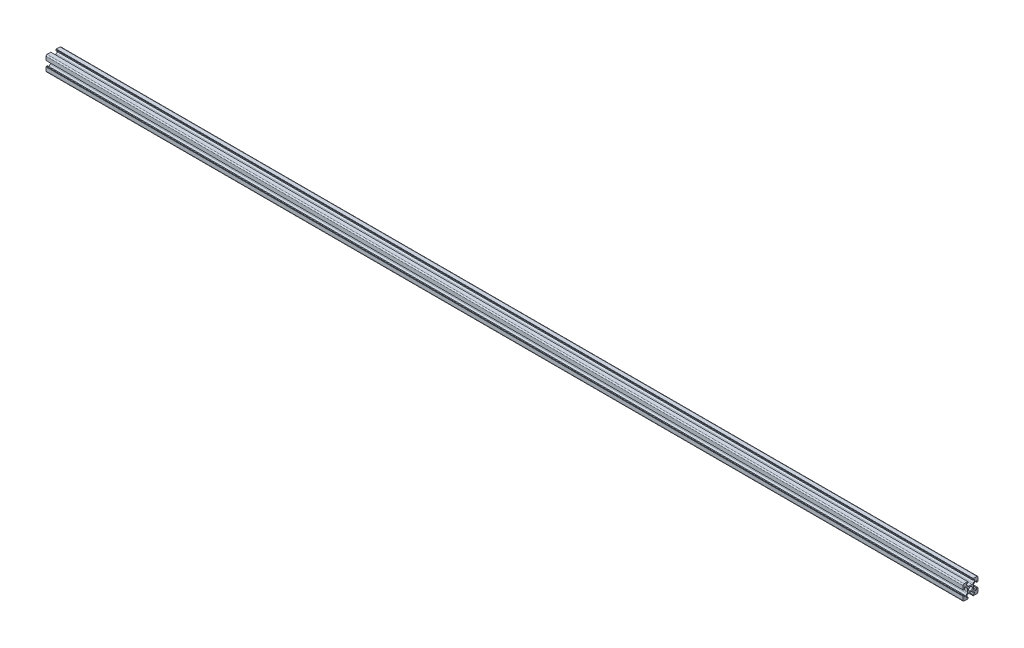
from build123d import *

# Parameters (mm, degrees)
SKETCH2_R           = 2.5
BOSS_EXTRUDE1_DEPTH = 1219.2


with BuildPart() as part:
    # Sketch2 → Boss-Extrude1 (new body)
    with BuildSketch(Plane.YZ):
        with BuildLine():
            Line((-10, 3.6), (-9.5, 3.6))
            Line((-9.5, 3.6), (-9.5, 3.1))
            Line((-9.5, 3.1), (-8.2, 3.1))
            Line((-8.2, 3.1), (-8.2, 5.5))
            Line((-8.2, 5.5), (-6.560660172, 5.5))
            Line((-6.560660172, 5.5), (-4.485786438, 3.425126266))
            ThreePointArc((-4.485786438, 3.425126266), (-4.052240935, 2.776279568), (-3.9, 2.010912703))
            Line((-3.9, 2.010912703), (-3.9, -2.010912703))
            ThreePointArc((-3.9, -2.010912703), (-4.052240935, -2.776279568), (-4.485786438, -3.425126266))
            Line((-4.485786438, -3.425126266), (-6.560660172, -5.5))
            Line((-6.560660172, -5.5), (-8.2, -5.5))
            Line((-8.2, -5.5), (-8.2, -3.1))
            Line((-8.2, -3.1), (-9.5, -3.1))
            Line((-9.5, -3.1), (-9.5, -3.6))
            Line((-9.5, -3.6), (-10, -3.6))
            Line((-10, -3.6), (-10, -8.5))
            ThreePointArc((-10, -8.5), (-9.560660172, -9.560660172), (-8.5, -10))
            Line((-8.5, -10), (-3.6, -10))
            Line((-3.6, -10), (-3.6, -9.5))
            Line((-3.6, -9.5), (-3.1, -9.5))
            Line((-3.1, -9.5), (-3.1, -8.2))
            Line((-3.1, -8.2), (-5.5, -8.2))
            Line((-5.5, -8.2), (-5.5, -6.560660172))
            Line((-5.5, -6.560660172), (-3.425126266, -4.485786438))
            ThreePointArc((-3.425126266, -4.485786438), (-2.776279568, -4.052240935), (-2.010912703, -3.9))
            Line((-2.010912703, -3.9), (2.010912703, -3.9))
            ThreePointArc((2.010912703, -3.9), (2.776279568, -4.052240935), (3.425126266, -4.485786438))
            Line((3.425126266, -4.485786438), (5.5, -6.560660172))
            Line((5.5, -6.560660172), (5.5, -8.2))
            Line((5.5, -8.2), (3.1, -8.2))
            Line((3.1, -8.2), (3.1, -9.5))
            Line((3.1, -9.5), (3.6, -9.5))
            Line((3.6, -9.5), (3.6, -10))
            Line((3.6, -10), (8.5, -10))
            ThreePointArc((8.5, -10), (9.560660172, -9.560660172), (10, -8.5))
            Line((10, -8.5), (10, -3.6))
            Line((10, -3.6), (9.5, -3.6))
            Line((9.5, -3.6), (9.5, -3.1))
            Line((9.5, -3.1), (8.2, -3.1))
            Line((8.2, -3.1), (8.2, -5.5))
            Line((8.2, -5.5), (6.560660172, -5.5))
            Line((6.560660172, -5.5), (4.485786438, -3.425126266))
            ThreePointArc((4.485786438, -3.425126266), (4.052240935, -2.776279568), (3.9, -2.010912703))
            Line((3.9, -2.010912703), (3.9, 2.010912703))
            ThreePointArc((3.9, 2.010912703), (4.052240935, 2.776279568), (4.485786438, 3.425126266))
            Line((4.485786438, 3.425126266), (6.560660172, 5.5))
            Line((6.560660172, 5.5), (8.2, 5.5))
            Line((8.2, 5.5), (8.2, 3.1))
            Line((8.2, 3.1), (9.5, 3.1))
            Line((9.5, 3.1), (9.5, 3.6))
            Line((9.5, 3.6), (10, 3.6))
            Line((10, 3.6), (10, 8.5))
            ThreePointArc((10, 8.5), (9.560660172, 9.560660172), (8.5, 10))
            Line((8.5, 10), (3.6, 10))
            Line((3.6, 10), (3.6, 9.5))
            Line((3.6, 9.5), (3.1, 9.5))
            Line((3.1, 9.5), (3.1, 8.2))
            Line((3.1, 8.2), (5.5, 8.2))
            Line((5.5, 8.2), (5.5, 6.560660172))
            Line((5.5, 6.560660172), (3.425126266, 4.485786438))
            ThreePointArc((3.425126266, 4.485786438), (2.776279568, 4.052240935), (2.010912703, 3.9))
            Line((2.010912703, 3.9), (-2.010912703, 3.9))
            ThreePointArc((-2.010912703, 3.9), (-2.776279568, 4.052240935), (-3.425126266, 4.485786438))
            Line((-3.425126266, 4.485786438), (-5.5, 6.560660172))
            Line((-5.5, 6.560660172), (-5.5, 8.2))
            Line((-5.5, 8.2), (-3.1, 8.2))
            Line((-3.1, 8.2), (-3.1, 9.5))
            Line((-3.1, 9.5), (-3.6, 9.5))
            Line((-3.6, 9.5), (-3.6, 10))
            Line((-3.6, 10), (-8.5, 10))
            ThreePointArc((-8.5, 10), (-9.560660172, 9.560660172), (-10, 8.5))
            Line((-10, 8.5), (-10, 3.6))
        make_face()
        with Locations(Location((0, 0, 0), (0, 0, 90))):
            Circle(SKETCH2_R, mode=Mode.SUBTRACT)
    extrude(amount=BOSS_EXTRUDE1_DEPTH)


solid = part.part
